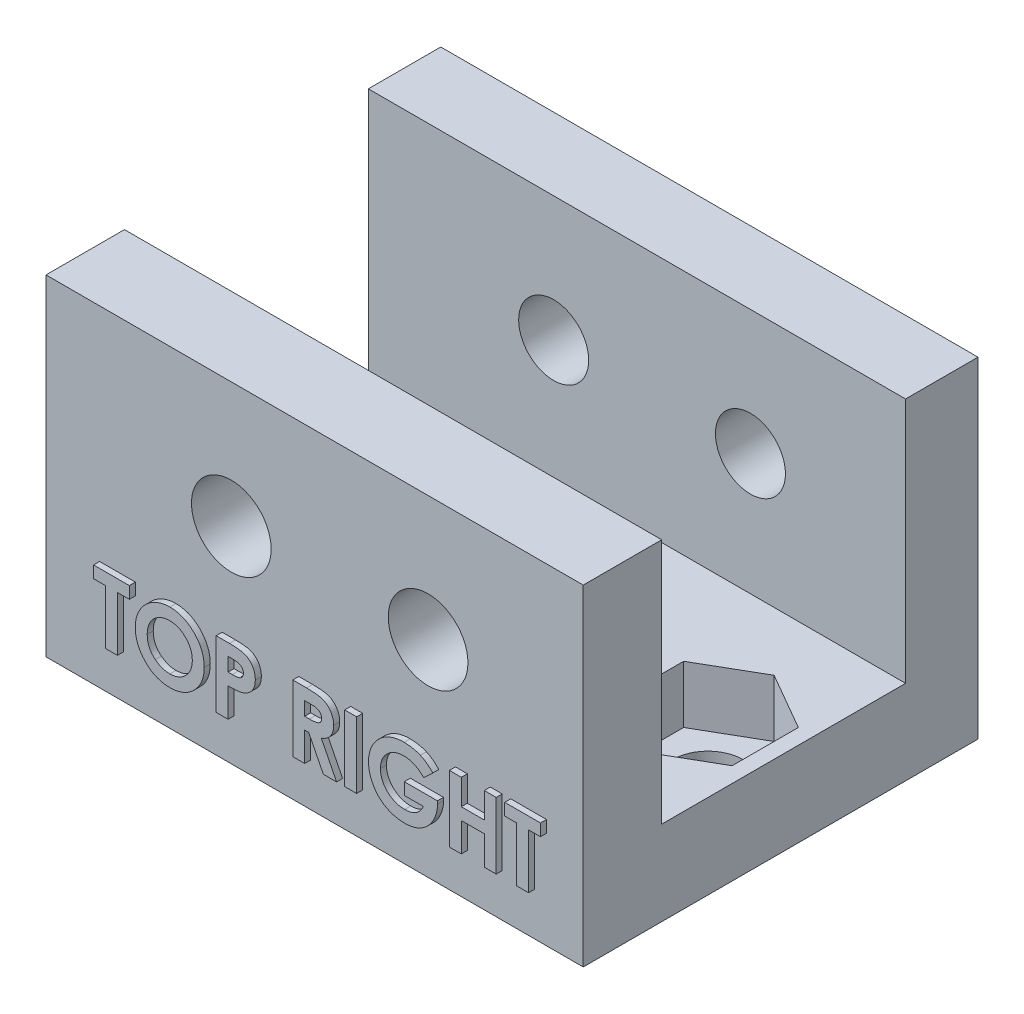
from build123d import *

# Parameters (mm, degrees)
SKETCH1_W                      = 44.5
SKETCH1_H                      = 20
BOSS_EXTRUDE1_DEPTH            = 6
SKETCH2_W                      = 44.5
SKETCH2_H                      = 0.4
SKETCH2_H_2                    = 7
BOSS_EXTRUDE2_DEPTH            = 6
SKETCH2_3_W                    = 44.5
SKETCH2_3_H                    = 7
BOSS_EXTRUDE3_DEPTH            = 20.2
BOSS_EXTRUDE4_DEPTH            = 6.5
SKETCH4_R                      = 2.9
CUT_EXTRUDE1_DEPTH             = 53.010696015
CUT_EXTRUDE2_DEPTH             = 4.75
SKETCH6_W                      = 18.5
SKETCH6_H                      = 30.7
CUT_EXTRUDE3_DEPTH             = 0.5
SKETCH10_W                     = 0.897435898
SKETCH10_H                     = 5
SKETCH10_W_2                   = 0.897435897
BOSS_EXTRUDE8_DEPTH            = 0.5
SKETCH24_W                     = 0.987179487
SKETCH24_H                     = 5.5
BOSS_EXTRUDE10_DEPTH           = 0.5
M5_CLEARANCE_HOLE4_D           = 5.8
M5_CLEARANCE_HOLE4_DEPTH       = 6
F_6_6_6_6_DIAMETER_HOLE3_D     = 6.6
F_6_6_6_6_DIAMETER_HOLE3_DEPTH = 6.5


with BuildPart() as part:
    # Sketch1 → Boss-Extrude1 (new body)
    with BuildSketch(Plane.XY):
        with Locations((7.5, 0)):
            Rectangle(SKETCH1_W, SKETCH1_H)
    extrude(amount=BOSS_EXTRUDE1_DEPTH)

    # Sketch2 → Boss-Extrude2 (add)
    with BuildSketch(Plane.XY.offset(6)):
        with Locations((7.5, -10.2)):
            Rectangle(SKETCH2_W, SKETCH2_H)
        with Locations((7.5, -13.9)):
            Rectangle(SKETCH2_W, SKETCH2_H_2)
    extrude(amount=-BOSS_EXTRUDE2_DEPTH)

    # Sketch2<3> → Boss-Extrude3 (add)
    with BuildSketch(Plane.XY.offset(6)):
        with Locations((7.5, -13.9)):
            Rectangle(SKETCH2_3_W, SKETCH2_3_H)
    extrude(amount=BOSS_EXTRUDE3_DEPTH)

    # Sketch3 → Boss-Extrude4 (add)
    with BuildSketch(Plane.XY.offset(26.2)):
        Polygon((-14.75, 10), (-14.75, -10.4), (-14.75, -17.4), (29.75, -17.4), (29.75, -10.4), (29.75, 10), align=None)
    extrude(amount=BOSS_EXTRUDE4_DEPTH)

    # Sketch4 → Cut-Extrude1 (cut, through all)
    with BuildSketch(Plane.XZ.offset(17.4)):
        with Locations(Location((-8.725, 16.35, 0), (0, 0, 270))):
            Circle(SKETCH4_R)
        with Locations(Location((23.725, 16.35, 0), (0, 0, 90))):
            Circle(SKETCH4_R)
    extrude(amount=-CUT_EXTRUDE1_DEPTH, mode=Mode.SUBTRACT)

    # Sketch5 → Cut-Extrude2 (cut)
    with BuildSketch(Plane(origin=(0, -10.4, 0), x_dir=(1, 0, 0), z_dir=(0, 1, 0))):
        Polygon((-8.725, -10.865172443), (-13.475, -13.607586221), (-13.475, -19.092413779), (-8.725, -21.834827557), (-3.975, -19.092413779), (-3.975, -13.607586221), align=None)
        Polygon((23.725, -10.865172443), (18.975, -13.607586221), (18.975, -19.092413779), (23.725, -21.834827557), (28.475, -19.092413779), (28.475, -13.607586221), align=None)
    extrude(amount=-CUT_EXTRUDE2_DEPTH, mode=Mode.SUBTRACT)

    # Sketch6 → Cut-Extrude3 (cut)
    with BuildSketch(Plane.XZ.offset(17.4)):
        with Locations((7.5, 16.35)):
            Rectangle(SKETCH6_W, SKETCH6_H)
    extrude(amount=-CUT_EXTRUDE3_DEPTH, mode=Mode.SUBTRACT)

    # Sketch10 → Boss-Extrude8 (add)
    # profile 1 of 10: a face of its own
    with BuildSketch(Plane(origin=(0, 0, 0), x_dir=(-1, 0, 0), z_dir=(0, 0, -1))):
        Polygon((-26.668714773, -7.143670574), (-23.976407081, -7.143670574), (-23.976407081, -8.041106471), (-24.873842978, -8.041106471), (-24.873842978, -12.143670574), (-25.771278876, -12.143670574), (-25.771278876, -8.041106471), (-26.668714773, -8.041106471), align=None)
    # profile 2 of 10: a face of its own
    with BuildSketch(Plane(origin=(0, 0, 0), x_dir=(-1, 0, 0), z_dir=(0, 0, -1))):
        Polygon((-23.271278876, -7.143670574), (-22.373842978, -7.143670574), (-22.373842978, -9.066747497), (-20.643073748, -9.066747497), (-20.643073748, -7.143670574), (-19.74563785, -7.143670574), (-19.74563785, -12.143670574), (-20.643073748, -12.143670574), (-20.643073748, -9.964183394), (-22.373842978, -9.964183394), (-22.373842978, -12.143670574), (-23.271278876, -12.143670574), align=None)
    # profile 3 of 10: a face of its own
    with BuildSketch(Plane(origin=(0, 0, 0), x_dir=(-1, 0, 0), z_dir=(0, 0, -1))):
        with Locations((-18.271278876, -9.643670574)):
            Rectangle(SKETCH10_W, SKETCH10_H)
    # profile 4 of 10: a face of its own
    with BuildSketch(Plane(origin=(0, 0, 0), x_dir=(-1, 0, 0), z_dir=(0, 0, -1))):
        with BuildLine():
            Line((-14.104612209, -7.811739484), (-14.775685927, -8.425721856))
            add(Edge.make_bspline(
                [(-14.775685927, -8.425721856), (-14.804431848, -8.385172746), (-14.859620007, -8.307324111), (-14.949074256, -8.203082953), (-15.038124573, -8.114157489), (-15.127595955, -8.040919206), (-15.218281443, -7.983813082), (-15.31002362, -7.943381316), (-15.402302374, -7.917678458), (-15.464299451, -7.914477834), (-15.494836568, -7.912901343)],
                knots=[0, 0, 0, 0, 1.299362458, 2.494594718, 3.587462134, 4.587049575, 5.512617175, 6.380583204, 7.202344345, 8, 8, 8, 8], degree=3))
            add(Edge.make_bspline(
                [(-15.494836568, -7.912901343), (-15.523320715, -7.91390028), (-15.578316118, -7.915828965), (-15.656716146, -7.934999949), (-15.726320806, -7.968086252), (-15.78706217, -8.011349377), (-15.835178291, -8.063471413), (-15.873595283, -8.118134027), (-15.895227277, -8.17846919), (-15.898074473, -8.219909814), (-15.899484004, -8.240425381)],
                knots=[0, 0, 0, 0, 1.185010067, 2.2879431, 3.333075148, 4.379039566, 5.372662701, 6.27520591, 7.14612461, 8, 8, 8, 8], degree=3))
            add(Edge.make_bspline(
                [(-15.899484004, -8.240425381), (-15.898600723, -8.261236792), (-15.896821916, -8.303148081), (-15.879641068, -8.364574295), (-15.853744624, -8.424594857), (-15.828999514, -8.461132229), (-15.816350991, -8.479808394)],
                knots=[0, 0, 0, 0, 0.967525499, 1.948461899, 2.951351359, 4, 4, 4, 4], degree=3))
            add(Edge.make_bspline(
                [(-15.816350991, -8.479808394), (-15.804852116, -8.494325182), (-15.778383224, -8.527740911), (-15.727912468, -8.580666217), (-15.664531799, -8.64550435), (-15.585802193, -8.720025715), (-15.494991935, -8.806910394), (-15.387891852, -8.902742915), (-15.26758475, -9.010491101), (-15.182073249, -9.085523036), (-15.137264453, -9.124840446)],
                knots=[0, 0, 0, 0, 0.473873513, 1.090794244, 1.870441696, 2.795289791, 3.865433203, 5.087734844, 6.473946851, 8, 8, 8, 8], degree=3))
            add(Edge.make_bspline(
                [(-15.137264453, -9.124840446), (-15.095204952, -9.161240822), (-15.015384758, -9.230321174), (-14.901816473, -9.328369642), (-14.802008864, -9.416581457), (-14.714507964, -9.493632751), (-14.6406402, -9.560331966), (-14.580095033, -9.616997924), (-14.532133004, -9.662527443), (-14.504869399, -9.690027301), (-14.493234004, -9.701763522)],
                knots=[0, 0, 0, 0, 1.543621617, 2.929473131, 4.163658386, 5.240097082, 6.164993805, 6.925417477, 7.541396219, 8, 8, 8, 8], degree=3))
            add(Edge.make_bspline(
                [(-14.493234004, -9.701763522), (-14.449091741, -9.749534906), (-14.364234808, -9.84136828), (-14.25395071, -9.98368113), (-14.163183329, -10.12260749), (-14.092963963, -10.260761484), (-14.039931473, -10.4001364), (-14.002542865, -10.5441504), (-13.980150579, -10.69430834), (-13.977664512, -10.796772803), (-13.976407081, -10.848598458)],
                knots=[0, 0, 0, 0, 1.206664779, 2.319633467, 3.337109185, 4.282041471, 5.190008762, 6.099243693, 7.03861361, 8, 8, 8, 8], degree=3))
            add(Edge.make_bspline(
                [(-13.976407081, -10.848598458), (-13.977302088, -10.899096203), (-13.979058126, -10.998174658), (-14.000566223, -11.143161219), (-14.031235506, -11.28191965), (-14.078655599, -11.412940063), (-14.136450927, -11.538373119), (-14.208905718, -11.65626497), (-14.293993935, -11.767808728), (-14.391518096, -11.871010414), (-14.499391399, -11.964658791), (-14.615095768, -12.048026788), (-14.739762619, -12.116857688), (-14.872326819, -12.173535025), (-15.012717408, -12.217188668), (-15.160767139, -12.249452779), (-15.316702465, -12.268817189), (-15.423333287, -12.270841509), (-15.477809325, -12.271875702)],
                knots=[0, 0, 0, 0, 1.043214005, 2.046824704, 3.02475056, 3.976699089, 4.921714032, 5.875962561, 6.831408892, 7.817874052, 8.806269674, 9.781291748, 10.760897367, 11.74438705, 12.757449933, 13.795994037, 14.874007457, 16, 16, 16, 16], degree=3))
            add(Edge.make_bspline(
                [(-15.477809325, -12.271875702), (-15.52057255, -12.271117054), (-15.605268261, -12.269614496), (-15.730096935, -12.257347357), (-15.85063313, -12.237549502), (-15.966741074, -12.20917326), (-16.078943853, -12.173216714), (-16.187246076, -12.129297169), (-16.290900096, -12.076733891), (-16.390690209, -12.016607788), (-16.486131311, -11.946793463), (-16.578430218, -11.868718247), (-16.66667013, -11.781181307), (-16.751274844, -11.684389665), (-16.831703036, -11.578069231), (-16.91058741, -11.463700713), (-16.984422107, -11.339161588), (-17.030033084, -11.251796383), (-17.053330158, -11.207172176)],
                knots=[0, 0, 0, 0, 1.016823716, 2.013894106, 2.979844003, 3.91962641, 4.853723003, 5.779685073, 6.695824784, 7.614987388, 8.547259901, 9.504950863, 10.487499108, 11.500346958, 12.559593716, 13.656357062, 14.802919212, 16, 16, 16, 16], degree=3))
            Line((-17.053330158, -11.207172176), (-16.264067337, -10.733414164))
            add(Edge.make_bspline(
                [(-16.264067337, -10.733414164), (-16.234926179, -10.784068469), (-16.179060089, -10.881177102), (-16.084389776, -11.011654857), (-15.987404873, -11.123387457), (-15.885863176, -11.21440002), (-15.780999395, -11.285909501), (-15.672307013, -11.337015137), (-15.559709665, -11.368649468), (-15.483013466, -11.372512751), (-15.44475644, -11.374439805)],
                knots=[0, 0, 0, 0, 1.283663364, 2.460892379, 3.537111102, 4.529833553, 5.449777664, 6.316464042, 7.160231139, 8, 8, 8, 8], degree=3))
            add(Edge.make_bspline(
                [(-15.44475644, -11.374439805), (-15.405843567, -11.372866068), (-15.330346927, -11.36981279), (-15.222585133, -11.34161058), (-15.123785041, -11.297331041), (-15.038382971, -11.234150245), (-14.966069882, -11.161230003), (-14.912698672, -11.0801029), (-14.879170518, -10.992325334), (-14.875625779, -10.931349262), (-14.873842978, -10.900681792)],
                knots=[0, 0, 0, 0, 1.13588714, 2.203786484, 3.234766741, 4.283437687, 5.291419208, 6.222934724, 7.106237994, 8, 8, 8, 8], degree=3))
            add(Edge.make_bspline(
                [(-14.873842978, -10.900681792), (-14.875489322, -10.872150701), (-14.878833711, -10.814192522), (-14.903467447, -10.72801803), (-14.941977492, -10.641882729), (-14.98753759, -10.571232224), (-15.033900695, -10.512078471), (-15.07823428, -10.460824421), (-15.13222086, -10.404197667), (-15.195723547, -10.34212698), (-15.267903306, -10.274065934), (-15.348820938, -10.200021194), (-15.439403037, -10.120645006), (-15.503426643, -10.066574731), (-15.536903876, -10.038301984)],
                knots=[0, 0, 0, 0, 0.916159276, 1.861089862, 2.860218735, 3.940849679, 4.552606315, 5.27541173, 6.11797699, 7.06649574, 8.129236253, 9.306560635, 10.591630461, 12, 12, 12, 12], degree=3))
            add(Edge.make_bspline(
                [(-15.536903876, -10.038301984), (-15.600545428, -9.984455128), (-15.722692829, -9.881106714), (-15.895302604, -9.728464359), (-16.050839466, -9.585806093), (-16.187960033, -9.451368345), (-16.308411432, -9.327633872), (-16.411377914, -9.213597652), (-16.495728346, -9.108380054), (-16.584488987, -8.983756851), (-16.668829342, -8.831894914), (-16.741723343, -8.649187399), (-16.789013894, -8.466503067), (-16.794312142, -8.343858868), (-16.796919902, -8.283494292)],
                knots=[0, 0, 0, 0, 1.345494975, 2.582412109, 3.71882943, 4.751509156, 5.681369928, 6.505683931, 7.230279997, 7.856715994, 8.973648664, 10.023341002, 11.027102913, 12, 12, 12, 12], degree=3))
            add(Edge.make_bspline(
                [(-16.796919902, -8.283494292), (-16.795835338, -8.240686974), (-16.793698631, -8.15635196), (-16.774638878, -8.03234961), (-16.746153351, -7.912697761), (-16.704784187, -7.797832957), (-16.651092007, -7.687899073), (-16.585884941, -7.582357934), (-16.508150445, -7.482180918), (-16.420548916, -7.387434436), (-16.32403446, -7.300846932), (-16.220896498, -7.224424785), (-16.111718801, -7.159877528), (-15.997169263, -7.106330891), (-15.876538066, -7.065344342), (-15.750713897, -7.036291033), (-15.619516283, -7.019011052), (-15.530278498, -7.016662039), (-15.484820543, -7.015465446)],
                knots=[0, 0, 0, 0, 1.010766082, 1.991317756, 2.957454644, 3.913069143, 4.869106762, 5.843196583, 6.838735724, 7.860187025, 8.887984031, 9.89767229, 10.887916223, 11.879572884, 12.879850636, 13.892031539, 14.926195476, 16, 16, 16, 16], degree=3))
            add(Edge.make_bspline(
                [(-15.484820543, -7.015465446), (-15.425909282, -7.017620545), (-15.308551785, -7.021913732), (-15.135035341, -7.055485054), (-14.965551733, -7.108279493), (-14.828978666, -7.171970176), (-14.720310025, -7.23366737), (-14.637025663, -7.290470375), (-14.552279342, -7.35554127), (-14.465387635, -7.429085111), (-14.377965125, -7.51248756), (-14.287525972, -7.603763157), (-14.195302519, -7.703700735), (-14.135371897, -7.775095677), (-14.104612209, -7.811739484)],
                knots=[0, 0, 0, 0, 1.282922637, 2.555718331, 3.837320111, 5.142675274, 5.830281639, 6.55870424, 7.337177975, 8.157850921, 9.037902056, 9.96903443, 10.957596896, 12, 12, 12, 12], degree=3))
        make_face()
    # profile 5 of 10: a face of its own
    with BuildSketch(Plane(origin=(0, 0, 0), x_dir=(-1, 0, 0), z_dir=(0, 0, -1))):
        with BuildLine():
            Line((-8.591791696, -7.811739484), (-9.262865414, -8.425721856))
            add(Edge.make_bspline(
                [(-9.262865414, -8.425721856), (-9.291611335, -8.385172746), (-9.346799494, -8.307324111), (-9.436253743, -8.203082953), (-9.52530406, -8.114157489), (-9.614775443, -8.040919206), (-9.705460931, -7.983813082), (-9.797203107, -7.943381316), (-9.889481861, -7.917678458), (-9.951478939, -7.914477834), (-9.982016055, -7.912901343)],
                knots=[0, 0, 0, 0, 1.299362458, 2.494594718, 3.587462134, 4.587049575, 5.512617175, 6.380583204, 7.202344345, 8, 8, 8, 8], degree=3))
            add(Edge.make_bspline(
                [(-9.982016055, -7.912901343), (-10.010500202, -7.91390028), (-10.065495605, -7.915828965), (-10.143895633, -7.934999949), (-10.213500294, -7.968086252), (-10.274241657, -8.011349377), (-10.322357778, -8.063471413), (-10.36077477, -8.118134027), (-10.382406764, -8.17846919), (-10.38525396, -8.219909814), (-10.386663491, -8.240425381)],
                knots=[0, 0, 0, 0, 1.185010067, 2.2879431, 3.333075148, 4.379039566, 5.372662701, 6.27520591, 7.14612461, 8, 8, 8, 8], degree=3))
            add(Edge.make_bspline(
                [(-10.386663491, -8.240425381), (-10.38578021, -8.261236792), (-10.384001403, -8.303148081), (-10.366820555, -8.364574295), (-10.340924111, -8.424594857), (-10.316179001, -8.461132229), (-10.303530478, -8.479808394)],
                knots=[0, 0, 0, 0, 0.967525499, 1.948461899, 2.951351359, 4, 4, 4, 4], degree=3))
            add(Edge.make_bspline(
                [(-10.303530478, -8.479808394), (-10.292031603, -8.494325182), (-10.265562711, -8.527740911), (-10.215091955, -8.580666217), (-10.151711286, -8.64550435), (-10.072981681, -8.720025715), (-9.982171423, -8.806910394), (-9.875071339, -8.902742915), (-9.754764237, -9.010491101), (-9.669252736, -9.085523036), (-9.62444394, -9.124840446)],
                knots=[0, 0, 0, 0, 0.473873513, 1.090794244, 1.870441696, 2.795289791, 3.865433203, 5.087734844, 6.473946851, 8, 8, 8, 8], degree=3))
            add(Edge.make_bspline(
                [(-9.62444394, -9.124840446), (-9.582384439, -9.161240822), (-9.502564245, -9.230321174), (-9.38899596, -9.328369642), (-9.289188352, -9.416581457), (-9.201687451, -9.493632751), (-9.127819688, -9.560331966), (-9.06727452, -9.616997924), (-9.019312491, -9.662527443), (-8.992048886, -9.690027301), (-8.980413491, -9.701763522)],
                knots=[0, 0, 0, 0, 1.543621617, 2.929473131, 4.163658386, 5.240097082, 6.164993805, 6.925417477, 7.541396219, 8, 8, 8, 8], degree=3))
            add(Edge.make_bspline(
                [(-8.980413491, -9.701763522), (-8.936271228, -9.749534906), (-8.851414295, -9.84136828), (-8.741130197, -9.98368113), (-8.650362817, -10.12260749), (-8.58014345, -10.260761484), (-8.52711096, -10.4001364), (-8.489722352, -10.5441504), (-8.467330066, -10.69430834), (-8.464844, -10.796772803), (-8.463586568, -10.848598458)],
                knots=[0, 0, 0, 0, 1.206664779, 2.319633467, 3.337109185, 4.282041471, 5.190008762, 6.099243693, 7.03861361, 8, 8, 8, 8], degree=3))
            add(Edge.make_bspline(
                [(-8.463586568, -10.848598458), (-8.464481576, -10.899096203), (-8.466237614, -10.998174658), (-8.48774571, -11.143161219), (-8.518414994, -11.28191965), (-8.565835086, -11.412940063), (-8.623630414, -11.538373119), (-8.696085205, -11.65626497), (-8.781173422, -11.767808728), (-8.878697583, -11.871010414), (-8.986570886, -11.964658791), (-9.102275255, -12.048026788), (-9.226942107, -12.116857688), (-9.359506306, -12.173535025), (-9.499896895, -12.217188668), (-9.647946627, -12.249452779), (-9.803881952, -12.268817189), (-9.910512775, -12.270841509), (-9.964988812, -12.271875702)],
                knots=[0, 0, 0, 0, 1.043214005, 2.046824704, 3.02475056, 3.976699089, 4.921714032, 5.875962561, 6.831408892, 7.817874052, 8.806269674, 9.781291748, 10.760897367, 11.74438705, 12.757449933, 13.795994037, 14.874007457, 16, 16, 16, 16], degree=3))
            add(Edge.make_bspline(
                [(-9.964988812, -12.271875702), (-10.007752037, -12.271117054), (-10.092447748, -12.269614496), (-10.217276422, -12.257347357), (-10.337812617, -12.237549502), (-10.453920561, -12.20917326), (-10.566123341, -12.173216714), (-10.674425563, -12.129297169), (-10.778079583, -12.076733891), (-10.877869696, -12.016607788), (-10.973310798, -11.946793463), (-11.065609705, -11.868718247), (-11.153849617, -11.781181307), (-11.238454331, -11.684389665), (-11.318882524, -11.578069231), (-11.397766898, -11.463700713), (-11.471601594, -11.339161588), (-11.517212571, -11.251796383), (-11.540509645, -11.207172176)],
                knots=[0, 0, 0, 0, 1.016823716, 2.013894106, 2.979844003, 3.91962641, 4.853723003, 5.779685073, 6.695824784, 7.614987388, 8.547259901, 9.504950863, 10.487499108, 11.500346958, 12.559593716, 13.656357062, 14.802919212, 16, 16, 16, 16], degree=3))
            Line((-11.540509645, -11.207172176), (-10.751246825, -10.733414164))
            add(Edge.make_bspline(
                [(-10.751246825, -10.733414164), (-10.722105667, -10.784068469), (-10.666239576, -10.881177102), (-10.571569263, -11.011654857), (-10.47458436, -11.123387457), (-10.373042664, -11.21440002), (-10.268178882, -11.285909501), (-10.1594865, -11.337015137), (-10.046889152, -11.368649468), (-9.970192953, -11.372512751), (-9.931935927, -11.374439805)],
                knots=[0, 0, 0, 0, 1.283663364, 2.460892379, 3.537111102, 4.529833553, 5.449777664, 6.316464042, 7.160231139, 8, 8, 8, 8], degree=3))
            add(Edge.make_bspline(
                [(-9.931935927, -11.374439805), (-9.893023054, -11.372866068), (-9.817526414, -11.36981279), (-9.70976462, -11.34161058), (-9.610964528, -11.297331041), (-9.525562458, -11.234150245), (-9.453249369, -11.161230003), (-9.399878159, -11.0801029), (-9.366350005, -10.992325334), (-9.362805266, -10.931349262), (-9.361022466, -10.900681792)],
                knots=[0, 0, 0, 0, 1.13588714, 2.203786484, 3.234766741, 4.283437687, 5.291419208, 6.222934724, 7.106237994, 8, 8, 8, 8], degree=3))
            add(Edge.make_bspline(
                [(-9.361022466, -10.900681792), (-9.362668809, -10.872150701), (-9.366013198, -10.814192522), (-9.390646935, -10.72801803), (-9.429156979, -10.641882729), (-9.474717077, -10.571232224), (-9.521080182, -10.512078471), (-9.565413767, -10.460824421), (-9.619400347, -10.404197667), (-9.682903034, -10.34212698), (-9.755082793, -10.274065934), (-9.836000425, -10.200021194), (-9.926582524, -10.120645006), (-9.99060613, -10.066574731), (-10.024083363, -10.038301984)],
                knots=[0, 0, 0, 0, 0.916159276, 1.861089862, 2.860218735, 3.940849679, 4.552606315, 5.27541173, 6.11797699, 7.06649574, 8.129236253, 9.306560635, 10.591630461, 12, 12, 12, 12], degree=3))
            add(Edge.make_bspline(
                [(-10.024083363, -10.038301984), (-10.087724915, -9.984455128), (-10.209872316, -9.881106714), (-10.382482091, -9.728464359), (-10.538018954, -9.585806093), (-10.67513952, -9.451368345), (-10.795590919, -9.327633872), (-10.898557401, -9.213597652), (-10.982907833, -9.108380054), (-11.071668474, -8.983756851), (-11.156008829, -8.831894914), (-11.22890283, -8.649187399), (-11.276193381, -8.466503067), (-11.28149163, -8.343858868), (-11.284099389, -8.283494292)],
                knots=[0, 0, 0, 0, 1.345494975, 2.582412109, 3.71882943, 4.751509156, 5.681369928, 6.505683931, 7.230279997, 7.856715994, 8.973648664, 10.023341002, 11.027102913, 12, 12, 12, 12], degree=3))
            add(Edge.make_bspline(
                [(-11.284099389, -8.283494292), (-11.283014825, -8.240686974), (-11.280878119, -8.15635196), (-11.261818365, -8.03234961), (-11.233332838, -7.912697761), (-11.191963674, -7.797832957), (-11.138271494, -7.687899073), (-11.073064428, -7.582357934), (-10.995329932, -7.482180918), (-10.907728403, -7.387434436), (-10.811213947, -7.300846932), (-10.708075986, -7.224424785), (-10.598898289, -7.159877528), (-10.48434875, -7.106330891), (-10.363717554, -7.065344342), (-10.237893384, -7.036291033), (-10.106695771, -7.019011052), (-10.017457986, -7.016662039), (-9.97200003, -7.015465446)],
                knots=[0, 0, 0, 0, 1.010766082, 1.991317756, 2.957454644, 3.913069143, 4.869106762, 5.843196583, 6.838735724, 7.860187025, 8.887984031, 9.89767229, 10.887916223, 11.879572884, 12.879850636, 13.892031539, 14.926195476, 16, 16, 16, 16], degree=3))
            add(Edge.make_bspline(
                [(-9.97200003, -7.015465446), (-9.913088769, -7.017620545), (-9.795731272, -7.021913732), (-9.622214828, -7.055485054), (-9.45273122, -7.108279493), (-9.316158153, -7.171970176), (-9.207489512, -7.23366737), (-9.12420515, -7.290470375), (-9.039458829, -7.35554127), (-8.952567122, -7.429085111), (-8.865144612, -7.51248756), (-8.774705459, -7.603763157), (-8.682482006, -7.703700735), (-8.622551384, -7.775095677), (-8.591791696, -7.811739484)],
                knots=[0, 0, 0, 0, 1.282922637, 2.555718331, 3.837320111, 5.142675274, 5.830281639, 6.55870424, 7.337177975, 8.157850921, 9.037902056, 9.96903443, 10.957596896, 12, 12, 12, 12], degree=3))
        make_face()
    # profile 6 of 10: a face of its own
    with BuildSketch(Plane(origin=(0, 0, 0), x_dir=(-1, 0, 0), z_dir=(0, 0, -1))):
        with Locations((-7.245637851, -9.643670574)):
            Rectangle(SKETCH10_W_2, SKETCH10_H)
    # profile 7 of 10: a face of its own
    with BuildSketch(Plane(origin=(0, 0, 0), x_dir=(-1, 0, 0), z_dir=(0, 0, -1))):
        with BuildLine():
            Line((-5.643073748, -7.143670574), (-4.512264453, -7.143670574))
            add(Edge.make_bspline(
                [(-4.512264453, -7.143670574), (-4.424104862, -7.144286839), (-4.253691375, -7.145478088), (-4.006795947, -7.158900595), (-3.777214617, -7.179543458), (-3.564799392, -7.207941456), (-3.369985758, -7.245519785), (-3.193024923, -7.292654433), (-3.033322964, -7.347063543), (-2.889128782, -7.411086902), (-2.757493363, -7.485731779), (-2.632501332, -7.56888018), (-2.514398107, -7.663578074), (-2.401526297, -7.767998548), (-2.295342535, -7.884051944), (-2.194078483, -8.009815997), (-2.100213543, -8.147114459), (-2.010910382, -8.292655346), (-1.930147555, -8.447055447), (-1.8597032, -8.609000539), (-1.800691537, -8.777448447), (-1.752741505, -8.952578691), (-1.714519795, -9.133809893), (-1.687776835, -9.321507759), (-1.671244071, -9.515498514), (-1.66956696, -9.646975573), (-1.668714773, -9.713782753)],
                knots=[0, 0, 0, 0, 1.44355588, 2.790409838, 4.047694926, 5.217575253, 6.298404546, 7.294384826, 8.214239204, 9.058592145, 9.873746385, 10.689560431, 11.514393297, 12.350027578, 13.205127629, 14.088021785, 14.991911688, 15.926770944, 16.882954281, 17.842803888, 18.816321264, 19.80318086, 20.814351908, 21.847355356, 22.906180909, 24, 24, 24, 24], degree=3))
            add(Edge.make_bspline(
                [(-1.668714773, -9.713782753), (-1.670946259, -9.808052033), (-1.675339069, -9.993626627), (-1.712341645, -10.265955206), (-1.772187341, -10.527009311), (-1.856335824, -10.774746875), (-1.960657417, -11.006961759), (-2.085281241, -11.21955895), (-2.228380022, -11.411397334), (-2.38828665, -11.581521715), (-2.561426583, -11.727745925), (-2.741353887, -11.852976261), (-2.929821382, -11.95173083), (-3.095887584, -12.014355995), (-3.239887699, -12.053303429), (-3.366318242, -12.076321738), (-3.50993044, -12.097430915), (-3.672063349, -12.113743633), (-3.85200573, -12.128290569), (-4.050474834, -12.136194808), (-4.266828076, -12.142762057), (-4.417105858, -12.1433598), (-4.495237209, -12.143670574)],
                knots=[0, 0, 0, 0, 1.315458931, 2.589557908, 3.828601765, 5.048913369, 6.235739168, 7.376350998, 8.481830359, 9.569842114, 10.627874879, 11.640079404, 12.624025415, 13.590060155, 14.111227486, 14.704434459, 15.382649715, 16.137166398, 16.978595427, 17.902333227, 18.909396075, 20, 20, 20, 20], degree=3))
            Line((-4.495237209, -12.143670574), (-5.643073748, -12.143670574))
            Line((-5.643073748, -12.143670574), (-5.643073748, -7.143670574))
        make_face()
        with BuildLine():
            Line((-4.74563785, -8.041106471), (-4.74563785, -11.246234676))
            Line((-4.74563785, -11.246234676), (-4.27688785, -11.246234676))
            add(Edge.make_bspline(
                [(-4.27688785, -11.246234676), (-4.221113799, -11.246132475), (-4.113841732, -11.245935908), (-3.958965148, -11.23657326), (-3.815743579, -11.227175743), (-3.684571279, -11.209338942), (-3.564493617, -11.18947), (-3.457160145, -11.161819647), (-3.360358256, -11.132775294), (-3.275270364, -11.095798232), (-3.197336788, -11.054178088), (-3.125179199, -11.005415264), (-3.055526922, -10.951265987), (-2.989682165, -10.89013765), (-2.927395719, -10.822839707), (-2.869036111, -10.749025401), (-2.813824395, -10.668919943), (-2.763177751, -10.582099793), (-2.716896576, -10.489481794), (-2.675839988, -10.391963085), (-2.641798018, -10.288731545), (-2.613504417, -10.180753546), (-2.593285431, -10.067089017), (-2.576558076, -9.948579855), (-2.567934638, -9.824756537), (-2.566751124, -9.740503013), (-2.566150671, -9.697757112)],
                knots=[0, 0, 0, 0, 1.50275155, 2.890291501, 4.180787663, 5.369391935, 6.45668281, 7.458360028, 8.354766181, 9.177074746, 9.954075863, 10.732690366, 11.5210699, 12.329727389, 13.151100085, 13.990027547, 14.863562427, 15.770965086, 16.696477834, 17.652329173, 18.619756807, 19.62365428, 20.657822005, 21.729286259, 22.847956731, 24, 24, 24, 24], degree=3))
            add(Edge.make_bspline(
                [(-2.566150671, -9.697757112), (-2.567346571, -9.63225306), (-2.569678483, -9.504525233), (-2.592166939, -9.318486865), (-2.628773855, -9.143303872), (-2.681008397, -8.979626404), (-2.746851657, -8.826994443), (-2.829269845, -8.686701104), (-2.924716, -8.556389652), (-3.000192215, -8.479944773), (-3.037905478, -8.441747497)],
                knots=[0, 0, 0, 0, 1.13821349, 2.219428113, 3.251817212, 4.244760574, 5.201143372, 6.134805572, 7.068016741, 8, 8, 8, 8], degree=3))
            add(Edge.make_bspline(
                [(-3.037905478, -8.441747497), (-3.075094327, -8.409198253), (-3.15104834, -8.34272011), (-3.284398627, -8.263062292), (-3.431343736, -8.193075092), (-3.595245332, -8.137583047), (-3.774519378, -8.093697573), (-3.970233634, -8.063430834), (-4.181340008, -8.043981749), (-4.327589585, -8.042085431), (-4.403089773, -8.041106471)],
                knots=[0, 0, 0, 0, 0.813307809, 1.661089106, 2.549956539, 3.493439533, 4.508053171, 5.589449661, 6.755572447, 8, 8, 8, 8], degree=3))
            Line((-4.403089773, -8.041106471), (-4.74563785, -8.041106471))
        make_face(mode=Mode.SUBTRACT)
    # profile 8 of 10: a face of its own
    with BuildSketch(Plane(origin=(0, 0, 0), x_dir=(-1, 0, 0), z_dir=(0, 0, -1))):
        Polygon((-0.771278876, -7.143670574), (1.921028816, -7.143670574), (1.921028816, -8.041106471), (0.126157022, -8.041106471), (0.126157022, -9.002644933), (1.921028816, -9.002644933), (1.921028816, -9.90008083), (0.126157022, -9.90008083), (0.126157022, -11.246234676), (1.921028816, -11.246234676), (1.921028816, -12.143670574), (-0.771278876, -12.143670574), align=None)
    # profile 9 of 10: a face of its own
    with BuildSketch(Plane(origin=(0, 0, 0), x_dir=(-1, 0, 0), z_dir=(0, 0, -1))):
        with BuildLine():
            Line((4.741541637, -7.143670574), (5.638977534, -7.143670574))
            Line((5.638977534, -7.143670574), (5.638977534, -10.396875702))
            add(Edge.make_bspline(
                [(5.638977534, -10.396875702), (5.639026332, -10.430603522), (5.639120586, -10.495748457), (5.643838945, -10.589210111), (5.648156569, -10.675120939), (5.655946788, -10.753386888), (5.667455613, -10.824041438), (5.67859991, -10.887538447), (5.693682614, -10.942741075), (5.716349507, -11.005576117), (5.751271748, -11.076174719), (5.808332753, -11.149754202), (5.874176271, -11.216906159), (5.95309352, -11.272800905), (6.041789528, -11.318014716), (6.139776951, -11.351513146), (6.246917661, -11.370133825), (6.320999584, -11.372976613), (6.359129778, -11.374439805)],
                knots=[0, 0, 0, 0, 1.155499968, 2.231836252, 3.205919964, 4.102923608, 4.924856345, 5.658536265, 6.31071849, 6.882491295, 7.94666036, 8.992281882, 10.060072772, 11.158554251, 12.289267114, 13.461410017, 14.693379945, 16, 16, 16, 16], degree=3))
            add(Edge.make_bspline(
                [(6.359129778, -11.374439805), (6.399638403, -11.373257734), (6.478623364, -11.370952895), (6.592230656, -11.348328412), (6.697488456, -11.312302487), (6.792168098, -11.260884311), (6.87617536, -11.199250616), (6.947285747, -11.128968888), (7.003405803, -11.049898953), (7.039982768, -10.976950916), (7.060518932, -10.9098086), (7.075911811, -10.849819489), (7.087196493, -10.779038276), (7.097434328, -10.698570363), (7.103586478, -10.607582256), (7.110257482, -10.506805694), (7.112702467, -10.395551136), (7.113119197, -10.3180825), (7.113336509, -10.277684997)],
                knots=[0, 0, 0, 0, 1.261321664, 2.459363699, 3.594844139, 4.716940403, 5.803436589, 6.833651888, 7.818396249, 8.814403945, 9.360733334, 10.004355033, 10.743453831, 11.592799886, 12.532235708, 13.585170094, 14.740740724, 16, 16, 16, 16], degree=3))
            Line((7.113336509, -10.277684997), (7.113336509, -7.143670574))
            Line((7.113336509, -7.143670574), (8.010772406, -7.143670574))
            Line((8.010772406, -7.143670574), (8.010772406, -10.12644301))
            add(Edge.make_bspline(
                [(8.010772406, -10.12644301), (8.010647781, -10.186873837), (8.010408139, -10.303076423), (8.006727956, -10.470067718), (7.998893512, -10.622587479), (7.992313483, -10.760680272), (7.979578874, -10.884160064), (7.966312399, -10.993554148), (7.949403134, -11.088474857), (7.924243166, -11.196530548), (7.880824509, -11.32095272), (7.810827941, -11.464219457), (7.72197183, -11.60448627), (7.616948346, -11.740210129), (7.498367226, -11.866293219), (7.368857667, -11.976977853), (7.230477254, -12.070605117), (7.081780011, -12.144885713), (6.922892487, -12.202818978), (6.752242609, -12.241747214), (6.569946745, -12.268047619), (6.444031546, -12.270574097), (6.379161829, -12.271875702)],
                knots=[0, 0, 0, 0, 1.170808336, 2.251350247, 3.235597562, 4.129743112, 4.929140599, 5.639994148, 6.264258765, 6.79612947, 7.788252245, 8.809469599, 9.879094798, 10.999557536, 12.129761673, 13.226370002, 14.293821979, 15.358369427, 16.438775801, 17.562147481, 18.744053101, 20, 20, 20, 20], degree=3))
            add(Edge.make_bspline(
                [(6.379161829, -12.271875702), (6.336061099, -12.271149727), (6.251024241, -12.269717394), (6.125962625, -12.257087953), (6.005066006, -12.238476907), (5.888561547, -12.211325306), (5.776044885, -12.17625051), (5.667545912, -12.133075879), (5.563467837, -12.082042235), (5.464393065, -12.023618977), (5.370443516, -11.960444281), (5.284578479, -11.890412471), (5.203843135, -11.818702665), (5.130569894, -11.742297008), (5.06420841, -11.66199763), (5.004895353, -11.577622546), (4.952718844, -11.489179251), (4.906366411, -11.39507356), (4.866693253, -11.29052242), (4.833247289, -11.171806903), (4.804028109, -11.037066264), (4.782314138, -10.885996937), (4.762628125, -10.719096832), (4.750167964, -10.535931147), (4.743649492, -10.336494627), (4.742262009, -10.198229423), (4.741541637, -10.12644301)],
                knots=[0, 0, 0, 0, 1.001158378, 1.975264943, 2.917723546, 3.841610987, 4.75185031, 5.653588123, 6.552117133, 7.442167995, 8.324307438, 9.179605724, 10.014504199, 10.831958861, 11.636465792, 12.43274043, 13.225645099, 14.020104002, 14.867201867, 15.819789774, 16.883317127, 18.068162734, 19.364263498, 20.787406516, 22.332041935, 24, 24, 24, 24], degree=3))
            Line((4.741541637, -10.12644301), (4.741541637, -7.143670574))
        make_face()
    # profile 10 of 10: a face of its own
    with BuildSketch(Plane(origin=(0, 0, 0), x_dir=(-1, 0, 0), z_dir=(0, 0, -1))):
        with BuildLine():
            Line((9.16461856, -7.143670574), (10.166221124, -7.143670574))
            add(Edge.make_bspline(
                [(10.166221124, -7.143670574), (10.231664536, -7.143963512), (10.357918596, -7.144528652), (10.539987338, -7.151381727), (10.707954667, -7.163662855), (10.861781992, -7.178840386), (11.001406065, -7.200118694), (11.127001735, -7.224512609), (11.238595068, -7.254231497), (11.337444444, -7.289507404), (11.426158566, -7.331096321), (11.510110738, -7.375391486), (11.587403632, -7.428256204), (11.661938455, -7.483992939), (11.72945392, -7.5479262), (11.794162048, -7.615801136), (11.853322273, -7.690309612), (11.907208721, -7.770549721), (11.956092033, -7.855038971), (11.998799764, -7.943928402), (12.033441884, -8.037358674), (12.062502315, -8.134725397), (12.085843937, -8.23602433), (12.101380863, -8.341878469), (12.111934325, -8.4515487), (12.112865522, -8.526190329), (12.113336509, -8.56394301)],
                knots=[0, 0, 0, 0, 1.698747864, 3.27724071, 4.728299578, 6.070144658, 7.288476769, 8.393259625, 9.389771311, 10.283485332, 11.113357557, 11.931608583, 12.74405601, 13.541433047, 14.344816069, 15.154114104, 15.974336324, 16.810834471, 17.661136416, 18.50621059, 19.367396281, 20.244825668, 21.142564693, 22.063065223, 23.020325768, 24, 24, 24, 24], degree=3))
            add(Edge.make_bspline(
                [(12.113336509, -8.56394301), (12.11265505, -8.605707902), (12.111315901, -8.687781046), (12.09818792, -8.808090207), (12.075761182, -8.9227941), (12.046450608, -9.032860042), (12.005579097, -9.136477205), (11.958885315, -9.236117927), (11.901437153, -9.328988587), (11.835793443, -9.416250886), (11.764103023, -9.498614307), (11.684663965, -9.573700762), (11.598990412, -9.642022113), (11.507578298, -9.704294373), (11.410084433, -9.760391925), (11.306579165, -9.810840064), (11.196355701, -9.8540253), (11.119599397, -9.876610829), (11.080684265, -9.888061599)],
                knots=[0, 0, 0, 0, 1.102006807, 2.165578795, 3.188629044, 4.184801286, 5.166646146, 6.124351954, 7.085497154, 8.042432466, 9.003981491, 9.963833307, 10.922997304, 11.89326795, 12.880200226, 13.889073926, 14.929769137, 16, 16, 16, 16], degree=3))
            add(Edge.make_bspline(
                [(11.080684265, -9.888061599), (11.055052521, -9.894438819), (10.999525909, -9.90825393), (10.907644618, -9.922279735), (10.801761077, -9.9351756), (10.681532895, -9.946258035), (10.546890758, -9.953791509), (10.397965036, -9.959674816), (10.234688236, -9.963952589), (10.121152006, -9.964104383), (10.062054457, -9.964183394)],
                knots=[0, 0, 0, 0, 0.618981996, 1.340914327, 2.176866532, 3.120127938, 4.170906482, 5.338178032, 6.614476169, 8, 8, 8, 8], degree=3))
            Line((10.062054457, -9.964183394), (10.062054457, -12.143670574))
            Line((10.062054457, -12.143670574), (9.16461856, -12.143670574))
            Line((9.16461856, -12.143670574), (9.16461856, -7.143670574))
        make_face()
        with BuildLine():
            Line((10.062054457, -9.066747497), (10.37956247, -9.066747497))
            add(Edge.make_bspline(
                [(10.37956247, -9.066747497), (10.437338066, -9.066381155), (10.54364602, -9.06570708), (10.688825145, -9.055959564), (10.805493882, -9.041073139), (10.897664351, -9.019722563), (10.970441667, -8.987320236), (11.033207545, -8.949836846), (11.087043441, -8.902440128), (11.133657403, -8.848281268), (11.170923861, -8.786050023), (11.196766209, -8.716759709), (11.213552889, -8.641866189), (11.215103295, -8.589745256), (11.215900611, -8.562941407)],
                knots=[0, 0, 0, 0, 1.8619151, 3.425951444, 4.686033666, 5.651700536, 6.461346321, 7.243864085, 7.999046032, 8.762387399, 9.539336099, 10.322741239, 11.137448474, 12, 12, 12, 12], degree=3))
            add(Edge.make_bspline(
                [(11.215900611, -8.562941407), (11.215111497, -8.539523233), (11.213580425, -8.494086346), (11.202332757, -8.428509647), (11.184407208, -8.367378636), (11.158433778, -8.311331745), (11.124856283, -8.260464207), (11.083918521, -8.21479606), (11.036145805, -8.173349283), (10.999262474, -8.15141087), (10.980524009, -8.140265125)],
                knots=[0, 0, 0, 0, 1.102301479, 2.1387299, 3.123554645, 4.094223062, 5.036071848, 5.982632524, 6.975082478, 8, 8, 8, 8], degree=3))
            add(Edge.make_bspline(
                [(10.980524009, -8.140265125), (10.964651447, -8.132237915), (10.93104598, -8.115242667), (10.873812612, -8.095484449), (10.80776618, -8.078816215), (10.732460795, -8.064981741), (10.648196872, -8.054244753), (10.554989446, -8.046033644), (10.452701352, -8.042731637), (10.381566103, -8.041663135), (10.34450638, -8.041106471)],
                knots=[0, 0, 0, 0, 0.656809284, 1.390599849, 2.23162475, 3.173112763, 4.218524733, 5.370385145, 6.63003504, 8, 8, 8, 8], degree=3))
            Line((10.34450638, -8.041106471), (10.062054457, -8.041106471))
            Line((10.062054457, -8.041106471), (10.062054457, -9.066747497))
        make_face(mode=Mode.SUBTRACT)
    extrude(amount=BOSS_EXTRUDE8_DEPTH)

    # Sketch24 → Boss-Extrude10 (add)
    # profile 1 of 8: a face of its own
    with BuildSketch(Plane.XY.offset(32.7)):
        Polygon((-10.310357306, -8.335872695), (-7.348818845, -8.335872695), (-7.348818845, -9.323052182), (-8.335998332, -9.323052182), (-8.335998332, -13.835872695), (-9.323177819, -13.835872695), (-9.323177819, -9.323052182), (-10.310357306, -9.323052182), align=None)
    # profile 2 of 8: a face of its own
    with BuildSketch(Plane.XY.offset(32.7)):
        with BuildLine():
            add(Edge.make_bspline(
                [(-3.988442242, -8.194847054), (-3.892818001, -8.197322937), (-3.704034092, -8.20221089), (-3.426401086, -8.242955798), (-3.158850351, -8.309343783), (-2.901502872, -8.401627883), (-2.655003018, -8.522307623), (-2.418481301, -8.66796165), (-2.192784931, -8.841339099), (-1.980226663, -9.038395359), (-1.783784488, -9.252685437), (-1.613567228, -9.483406804), (-1.468412194, -9.724581238), (-1.348107313, -9.976854972), (-1.256472753, -10.241975122), (-1.192168993, -10.518589925), (-1.150857013, -10.806620689), (-1.146105499, -11.00273038), (-1.14369064, -11.102399137)],
                knots=[0, 0, 0, 0, 1.014329547, 2.002516266, 2.970391464, 3.935626869, 4.897733899, 5.877609409, 6.878433252, 7.912639331, 8.949961323, 9.958554974, 10.949718813, 11.932905612, 12.9188844, 13.919928257, 14.942845884, 16, 16, 16, 16], degree=3))
            add(Edge.make_bspline(
                [(-1.14369064, -11.102399137), (-1.146262361, -11.200944859), (-1.15133002, -11.395132364), (-1.190482457, -11.68050881), (-1.255869101, -11.954160493), (-1.345949466, -12.21670683), (-1.464072471, -12.466876135), (-1.606396825, -12.706265705), (-1.776678195, -12.932653948), (-1.968705752, -13.145919375), (-2.180111428, -13.339503512), (-2.404023598, -13.510099199), (-2.639408376, -13.654655545), (-2.885921232, -13.773106339), (-3.144090803, -13.865031637), (-3.413279376, -13.929891615), (-3.693470296, -13.969308333), (-3.884013709, -13.974342891), (-3.980729902, -13.976898336)],
                knots=[0, 0, 0, 0, 1.051557043, 2.072126891, 3.067553643, 4.050577992, 5.02905126, 6.015227836, 7.017913613, 8.04756643, 9.074058332, 10.072836633, 11.047628519, 12.017157415, 12.98668631, 13.966869689, 14.968021931, 16, 16, 16, 16], degree=3))
            add(Edge.make_bspline(
                [(-3.980729902, -13.976898336), (-4.081883443, -13.974605976), (-4.280636325, -13.970101801), (-4.571512058, -13.927269153), (-4.850196143, -13.862748224), (-5.114347475, -13.766454197), (-5.366656208, -13.646078567), (-5.605268557, -13.497828762), (-5.830104332, -13.321949776), (-6.039873838, -13.122945935), (-6.229925518, -12.905192084), (-6.397683405, -12.675154451), (-6.539190904, -12.434590321), (-6.654453192, -12.183387105), (-6.74532135, -11.923105969), (-6.809418511, -11.652161727), (-6.847282234, -11.371204201), (-6.852556431, -11.180372233), (-6.855229101, -11.083669169)],
                knots=[0, 0, 0, 0, 1.067978421, 2.098431617, 3.099715153, 4.085208694, 5.062210972, 6.048429807, 7.046490867, 8.072918869, 9.098532598, 10.095778865, 11.076610158, 12.041847152, 13.011192615, 13.984257998, 14.978533688, 16, 16, 16, 16], degree=3))
            add(Edge.make_bspline(
                [(-6.855229101, -11.083669169), (-6.854390263, -11.018612411), (-6.852723209, -10.889322661), (-6.832641783, -10.697721852), (-6.803730304, -10.509860834), (-6.760971597, -10.32648861), (-6.709030698, -10.146311576), (-6.641733926, -9.971006864), (-6.565131987, -9.798701737), (-6.475629833, -9.631431335), (-6.376112093, -9.470734685), (-6.267529378, -9.317369822), (-6.149608658, -9.17319115), (-6.022729796, -9.037251187), (-5.886455549, -8.910443476), (-5.742578464, -8.790972878), (-5.588308164, -8.682012956), (-5.427021142, -8.580902692), (-5.259626697, -8.489470434), (-5.086806275, -8.41164603), (-4.91212032, -8.343683304), (-4.733235261, -8.290044115), (-4.552068172, -8.246355557), (-4.366683648, -8.217463564), (-4.178756534, -8.197382694), (-4.052030891, -8.195694273), (-3.988442242, -8.194847054)],
                knots=[0, 0, 0, 0, 1.034744296, 2.056386356, 3.06226378, 4.057406941, 5.050368692, 6.043467995, 7.042652155, 8.049140477, 9.059438543, 10.048523776, 11.036952808, 12.020949711, 13.004946614, 13.997082645, 14.994316842, 16.007702937, 17.024872941, 18.026463647, 19.021641123, 20.005082605, 20.995858141, 21.984425357, 22.988620895, 24, 24, 24, 24], degree=3))
        make_face()
        with BuildLine():
            add(Edge.make_bspline(
                [(-4.003866922, -9.182026541), (-4.068222023, -9.183753333), (-4.19523324, -9.187161329), (-4.381535565, -9.21312565), (-4.560392377, -9.254593622), (-4.7308122, -9.314659473), (-4.89353365, -9.391108057), (-5.048845182, -9.483672252), (-5.194596051, -9.59553385), (-5.332729705, -9.7206875), (-5.457510731, -9.860137428), (-5.567758704, -10.009581741), (-5.6600185, -10.168770872), (-5.737286657, -10.336225989), (-5.795452454, -10.513830081), (-5.836882207, -10.700191957), (-5.863064265, -10.895632726), (-5.866364546, -11.028864445), (-5.868049614, -11.096890323)],
                knots=[0, 0, 0, 0, 1.033739768, 2.040188636, 3.016340934, 3.979330865, 4.937572243, 5.900995986, 6.878200029, 7.884839167, 8.891893314, 9.879764717, 10.863503415, 11.843163062, 12.837761627, 13.859916423, 14.907309254, 16, 16, 16, 16], degree=3))
            add(Edge.make_bspline(
                [(-5.868049614, -11.096890323), (-5.865815471, -11.172278299), (-5.861436921, -11.32002624), (-5.830628911, -11.535556956), (-5.777919472, -11.739104326), (-5.701808068, -11.92967283), (-5.607409958, -12.109378589), (-5.490182488, -12.276019052), (-5.352024187, -12.430591986), (-5.245588151, -12.520838103), (-5.191567242, -12.566641926)],
                knots=[0, 0, 0, 0, 1.078454662, 2.113592447, 3.107694534, 4.079536787, 5.043276885, 6.005368276, 6.987637804, 8, 8, 8, 8], degree=3))
            add(Edge.make_bspline(
                [(-5.191567242, -12.566641926), (-5.147313804, -12.600480031), (-5.059803966, -12.667393862), (-4.920119213, -12.753157664), (-4.776271422, -12.826665798), (-4.627175081, -12.886059501), (-4.473145075, -12.932777589), (-4.314202526, -12.965493497), (-4.150572642, -12.98602556), (-4.039918445, -12.98847953), (-3.984035191, -12.989718849)],
                knots=[0, 0, 0, 0, 1.023928204, 2.024787132, 3.009472467, 3.9914905, 4.972207045, 5.96565515, 6.972602802, 8, 8, 8, 8], degree=3))
            add(Edge.make_bspline(
                [(-3.984035191, -12.989718849), (-3.920786677, -12.987977416), (-3.796343237, -12.984551091), (-3.61350903, -12.958906405), (-3.438348307, -12.915506337), (-3.269773655, -12.855967405), (-3.108271168, -12.778558944), (-2.954630152, -12.683123698), (-2.808581234, -12.570833489), (-2.670623561, -12.444036297), (-2.544523726, -12.304037033), (-2.434505818, -12.153795599), (-2.339312621, -11.996622263), (-2.263651257, -11.830292475), (-2.20318746, -11.656376311), (-2.162256335, -11.474103533), (-2.135853099, -11.284225539), (-2.132551888, -11.155006854), (-2.130870127, -11.089177984)],
                knots=[0, 0, 0, 0, 1.026359118, 2.019393844, 2.989460624, 3.950973911, 4.916101784, 5.890408035, 6.881132271, 7.902007068, 8.92769091, 9.933912415, 10.920395702, 11.90457117, 12.894218921, 13.903490204, 14.931958862, 16, 16, 16, 16], degree=3))
            add(Edge.make_bspline(
                [(-2.130870127, -11.089177984), (-2.132610077, -11.023727647), (-2.136034904, -10.894898643), (-2.161724726, -10.705508824), (-2.204849562, -10.524040727), (-2.264567283, -10.350197995), (-2.340823651, -10.183810198), (-2.435122385, -10.025462455), (-2.547132604, -9.875307847), (-2.674276399, -9.734369622), (-2.812664605, -9.604856421), (-2.961238173, -9.492462506), (-3.115839845, -9.394795768), (-3.28001694, -9.318287588), (-3.450410532, -9.257333684), (-3.62806037, -9.212446354), (-3.813639315, -9.18734373), (-3.939892509, -9.183814736), (-4.003866922, -9.182026541)],
                knots=[0, 0, 0, 0, 1.055025985, 2.07665775, 3.074803781, 4.057872707, 5.035505728, 6.020516407, 7.023567878, 8.050795229, 9.077271434, 10.074415901, 11.050397877, 12.019801805, 12.988065821, 13.964604439, 14.968634123, 16, 16, 16, 16], degree=3))
        make_face(mode=Mode.SUBTRACT)
    # profile 3 of 8: a face of its own
    with BuildSketch(Plane.XY.offset(32.7)):
        with BuildLine():
            Line((-0.156511152, -8.335872695), (0.945251668, -8.335872695))
            add(Edge.make_bspline(
                [(0.945251668, -8.335872695), (1.017239422, -8.336194928), (1.156118887, -8.336816582), (1.356394503, -8.344354964), (1.541158565, -8.357864204), (1.710368623, -8.374559489), (1.863955103, -8.397965628), (2.002110341, -8.424798934), (2.124863007, -8.45748971), (2.23359732, -8.496293209), (2.331182854, -8.542041017), (2.423530244, -8.590765699), (2.508552427, -8.648916888), (2.590540732, -8.710227297), (2.664807744, -8.780553884), (2.735986685, -8.855216314), (2.801062932, -8.937175637), (2.860338025, -9.025439757), (2.914109668, -9.118377932), (2.961088172, -9.216156307), (2.999194504, -9.318929605), (3.031160979, -9.426033001), (3.056836762, -9.537461827), (3.073927381, -9.65390138), (3.085536189, -9.774538634), (3.086560506, -9.856644426), (3.087078591, -9.898172375)],
                knots=[0, 0, 0, 0, 1.698747864, 3.27724071, 4.728299578, 6.070144658, 7.288476769, 8.393259625, 9.389771311, 10.283485332, 11.113357557, 11.931608583, 12.74405601, 13.541433047, 14.344816069, 15.154114104, 15.974336324, 16.810834471, 17.661136416, 18.50621059, 19.367396281, 20.244825668, 21.142564693, 22.063065223, 23.020325768, 24, 24, 24, 24], degree=3))
            add(Edge.make_bspline(
                [(3.087078591, -9.898172375), (3.086328987, -9.944113756), (3.084855923, -10.034394215), (3.070415144, -10.166734292), (3.045745732, -10.292908573), (3.013504101, -10.41398111), (2.968545439, -10.527959989), (2.917182278, -10.637564783), (2.853989299, -10.73972251), (2.781781219, -10.835711038), (2.702921757, -10.926310801), (2.615538793, -11.008905902), (2.521297885, -11.084059388), (2.420744559, -11.152558874), (2.313501308, -11.214266182), (2.199645513, -11.269759134), (2.078399703, -11.317262894), (1.993967768, -11.342106976), (1.951161123, -11.354702823)],
                knots=[0, 0, 0, 0, 1.102006807, 2.165578795, 3.188629044, 4.184801286, 5.166646146, 6.124351954, 7.085497154, 8.042432466, 9.003981491, 9.963833307, 10.922997304, 11.89326795, 12.880200226, 13.889073926, 14.929769137, 16, 16, 16, 16], degree=3))
            add(Edge.make_bspline(
                [(1.951161123, -11.354702823), (1.922966205, -11.361717765), (1.861886932, -11.376914387), (1.760817511, -11.392342772), (1.644345616, -11.406528224), (1.512094616, -11.418718903), (1.363988266, -11.427005723), (1.200169971, -11.433477362), (1.020565491, -11.438182912), (0.895675638, -11.438349885), (0.830668335, -11.438436798)],
                knots=[0, 0, 0, 0, 0.618981996, 1.340914327, 2.176866532, 3.120127938, 4.170906482, 5.338178032, 6.614476169, 8, 8, 8, 8], degree=3))
            Line((0.830668335, -11.438436798), (0.830668335, -13.835872695))
            Line((0.830668335, -13.835872695), (-0.156511152, -13.835872695))
            Line((-0.156511152, -13.835872695), (-0.156511152, -8.335872695))
        make_face()
        with BuildLine():
            Line((0.830668335, -10.451257311), (1.179927149, -10.451257311))
            add(Edge.make_bspline(
                [(1.179927149, -10.451257311), (1.243480304, -10.450854334), (1.360419054, -10.450112852), (1.520116091, -10.439390585), (1.648451702, -10.423015517), (1.749839218, -10.399529883), (1.829894265, -10.363887324), (1.898936731, -10.322655595), (1.958156217, -10.270519205), (2.009431575, -10.210944459), (2.050424679, -10.14249009), (2.078851261, -10.066270744), (2.09731661, -9.983887872), (2.099022057, -9.926554846), (2.099899104, -9.897070612)],
                knots=[0, 0, 0, 0, 1.8619151, 3.425951444, 4.686033666, 5.651700536, 6.461346321, 7.243864085, 7.999046032, 8.762387399, 9.539336099, 10.322741239, 11.137448474, 12, 12, 12, 12], degree=3))
            add(Edge.make_bspline(
                [(2.099899104, -9.897070612), (2.099031078, -9.871310621), (2.0973469, -9.821330045), (2.084974464, -9.749195676), (2.065256361, -9.681951564), (2.036685587, -9.620299984), (1.999750343, -9.564345692), (1.954718805, -9.51411073), (1.902168817, -9.468519275), (1.861597154, -9.444387021), (1.840984841, -9.432126702)],
                knots=[0, 0, 0, 0, 1.102301479, 2.1387299, 3.123554645, 4.094223062, 5.036071848, 5.982632524, 6.975082478, 8, 8, 8, 8], degree=3))
            add(Edge.make_bspline(
                [(1.840984841, -9.432126702), (1.823525023, -9.423296771), (1.78655901, -9.404601998), (1.723602305, -9.382867957), (1.650951229, -9.3645329), (1.568115306, -9.349314979), (1.475424991, -9.337504293), (1.372896822, -9.328472072), (1.260379919, -9.324839864), (1.182131145, -9.323664512), (1.14136545, -9.323052182)],
                knots=[0, 0, 0, 0, 0.656809284, 1.390599849, 2.23162475, 3.173112763, 4.218524733, 5.370385145, 6.63003504, 8, 8, 8, 8], degree=3))
            Line((1.14136545, -9.323052182), (0.830668335, -9.323052182))
            Line((0.830668335, -9.323052182), (0.830668335, -10.451257311))
        make_face(mode=Mode.SUBTRACT)
    # profile 4 of 8: a face of its own
    with BuildSketch(Plane.XY.offset(32.7)):
        with BuildLine():
            Line((6.189642694, -8.335872695), (7.339883078, -8.335872695))
            add(Edge.make_bspline(
                [(7.339883078, -8.335872695), (7.415913618, -8.33614256), (7.562141761, -8.336661586), (7.772994758, -8.344850441), (7.966692232, -8.356245905), (8.143520971, -8.373635686), (8.303405324, -8.396692434), (8.446505532, -8.423872523), (8.572817414, -8.454850063), (8.683406235, -8.493450521), (8.783207177, -8.536991253), (8.87623553, -8.587020352), (8.964543638, -8.642980729), (9.047541256, -8.706344852), (9.125949654, -8.775972817), (9.199916753, -8.851934711), (9.268397329, -8.934874659), (9.330967349, -9.024268587), (9.387994886, -9.118308949), (9.438395267, -9.217124864), (9.479380941, -9.32078505), (9.515596178, -9.427791395), (9.541680839, -9.539673576), (9.55982234, -9.655342399), (9.573104837, -9.775205032), (9.573868517, -9.856634383), (9.574258078, -9.898172375)],
                knots=[0, 0, 0, 0, 1.749336639, 3.364467119, 4.854658419, 6.213483162, 7.451590619, 8.570285859, 9.5643256, 10.440900261, 11.26203566, 12.067320669, 12.869050712, 13.665104639, 14.467235401, 15.27997916, 16.102287765, 16.939272006, 17.78853747, 18.631303466, 19.488103222, 20.351255419, 21.228522269, 22.127379805, 23.044756219, 24, 24, 24, 24], degree=3))
            add(Edge.make_bspline(
                [(9.574258078, -9.898172375), (9.573246138, -9.941528495), (9.571261907, -10.026541946), (9.560573759, -10.151419771), (9.541039183, -10.270894139), (9.511451225, -10.384615244), (9.47744371, -10.493998478), (9.432222439, -10.597025652), (9.381185765, -10.695195145), (9.320570999, -10.787118315), (9.254049254, -10.874836958), (9.176685864, -10.954990247), (9.093492788, -11.031886118), (8.99979344, -11.100708076), (8.899718176, -11.166109611), (8.791278604, -11.225380818), (8.675182438, -11.280011641), (8.593561084, -11.310477561), (8.551822181, -11.32605699)],
                knots=[0, 0, 0, 0, 1.099860209, 2.156625411, 3.176576793, 4.16617041, 5.135385252, 6.078461593, 7.016046972, 7.938469504, 8.868247731, 9.803980173, 10.76021508, 11.73834243, 12.748633912, 13.790971185, 14.870363756, 16, 16, 16, 16], degree=3))
            Line((8.551822181, -11.32605699), (9.82105295, -13.835872695))
            Line((9.82105295, -13.835872695), (8.723697181, -13.835872695))
            Line((8.723697181, -13.835872695), (7.511758078, -11.438436798))
            Line((7.511758078, -11.438436798), (7.176822181, -11.438436798))
            Line((7.176822181, -11.438436798), (7.176822181, -13.835872695))
            Line((7.176822181, -13.835872695), (6.189642694, -13.835872695))
            Line((6.189642694, -13.835872695), (6.189642694, -8.335872695))
        make_face()
        with BuildLine():
            Line((7.176822181, -10.451257311), (7.561337405, -10.451257311))
            add(Edge.make_bspline(
                [(7.561337405, -10.451257311), (7.608347588, -10.45072785), (7.698361986, -10.449714048), (7.827814513, -10.445011611), (7.945388281, -10.433681061), (8.05158819, -10.419365336), (8.146948629, -10.402835763), (8.230619017, -10.379147882), (8.303888586, -10.353765718), (8.36588909, -10.322222271), (8.418860895, -10.286350532), (8.464598659, -10.245599344), (8.502430348, -10.198435033), (8.533567757, -10.146139321), (8.557789276, -10.088249666), (8.57546913, -10.025401565), (8.585349553, -9.956879097), (8.58648633, -9.909589264), (8.587078591, -9.884951221)],
                knots=[0, 0, 0, 0, 1.688639943, 3.233382647, 4.650958383, 5.928841754, 7.082724185, 8.122798841, 9.049171256, 9.863274652, 10.613301712, 11.341792392, 12.054588806, 12.776240173, 13.521029143, 14.301969904, 15.115324896, 16, 16, 16, 16], degree=3))
            add(Edge.make_bspline(
                [(8.587078591, -9.884951221), (8.585958867, -9.855802618), (8.583759375, -9.798545588), (8.561933588, -9.716115542), (8.527191649, -9.639820895), (8.479569966, -9.570006365), (8.419596648, -9.508802129), (8.350772533, -9.454850107), (8.271612232, -9.412188885), (8.19831575, -9.384049997), (8.131633084, -9.36721421), (8.071454081, -9.35466833), (8.001766434, -9.345776705), (7.922517532, -9.336345555), (7.833909382, -9.330229931), (7.735459019, -9.325766744), (7.62744919, -9.323940635), (7.55215608, -9.32335686), (7.512859841, -9.323052182)],
                knots=[0, 0, 0, 0, 1.020303359, 2.004196876, 2.966617323, 3.9489082, 4.950758222, 5.960522915, 7.003732012, 8.091992268, 8.70421221, 9.413913587, 10.24622431, 11.166358409, 12.212345909, 13.359657661, 14.621978493, 16, 16, 16, 16], degree=3))
            Line((7.512859841, -9.323052182), (7.176822181, -9.323052182))
            Line((7.176822181, -9.323052182), (7.176822181, -10.451257311))
        make_face(mode=Mode.SUBTRACT)
    # profile 5 of 8: a face of its own
    with BuildSketch(Plane.XY.offset(32.7)):
        with Locations((10.984514489, -11.085872695)):
            Rectangle(SKETCH24_W, SKETCH24_H)
    # profile 6 of 8: a face of its own
    with BuildSketch(Plane.XY.offset(32.7)):
        with BuildLine():
            Line((17.787899905, -9.210672375), (17.040904713, -9.925716445))
            add(Edge.make_bspline(
                [(17.040904713, -9.925716445), (16.9817638, -9.866504671), (16.865719565, -9.750321395), (16.675943736, -9.599100876), (16.479393572, -9.47053354), (16.275422148, -9.364816484), (16.063745331, -9.282813144), (15.844780849, -9.22415353), (15.618172475, -9.18936152), (15.464768722, -9.184490757), (15.387158719, -9.182026541)],
                knots=[0, 0, 0, 0, 1.075575784, 2.110457258, 3.113929901, 4.09197124, 5.059417775, 6.02750972, 7.002078037, 8, 8, 8, 8], degree=3))
            add(Edge.make_bspline(
                [(15.387158719, -9.182026541), (15.31987322, -9.183753206), (15.187752245, -9.187143664), (14.993613196, -9.212890566), (14.808101442, -9.255899609), (14.63034055, -9.315481457), (14.461415811, -9.393016273), (14.300348444, -9.487307396), (14.148129659, -9.599076164), (14.005958069, -9.726203828), (13.876510379, -9.86500157), (13.76349571, -10.013564233), (13.667231492, -10.169122736), (13.587986407, -10.332472939), (13.527689515, -10.503364131), (13.484645425, -10.681672255), (13.457323131, -10.866879122), (13.454097184, -10.993229165), (13.452463207, -11.057226862)],
                knots=[0, 0, 0, 0, 1.075001177, 2.110859044, 3.123021556, 4.114053297, 5.101481495, 6.087880186, 7.091499647, 8.114004866, 9.131394192, 10.11971144, 11.092043119, 12.050101265, 13.015322563, 13.981809771, 14.977764287, 16, 16, 16, 16], degree=3))
            add(Edge.make_bspline(
                [(13.452463207, -11.057226862), (13.453987303, -11.123439605), (13.456989981, -11.253887773), (13.485834101, -11.445326067), (13.530273434, -11.629503501), (13.595320768, -11.805053521), (13.675374337, -11.974380917), (13.776895452, -12.134205656), (13.895279231, -12.286968439), (14.030314139, -12.430009575), (14.177197247, -12.561859078), (14.336276432, -12.675595854), (14.50271153, -12.77372614), (14.679188811, -12.851442155), (14.862645151, -12.913839601), (15.054941326, -12.957835155), (15.255644329, -12.984826275), (15.392582179, -12.988071756), (15.462078591, -12.989718849)],
                knots=[0, 0, 0, 0, 1.022067601, 2.013613092, 2.983553406, 3.943623673, 4.90013463, 5.87121881, 6.861774014, 7.881098904, 8.905697761, 9.905387765, 10.89678721, 11.884561068, 12.87834324, 13.885584958, 14.926927371, 16, 16, 16, 16], degree=3))
            add(Edge.make_bspline(
                [(15.462078591, -12.989718849), (15.507283434, -12.989310974), (15.596030598, -12.988510223), (15.726207563, -12.975511794), (15.850885829, -12.956929028), (15.97054824, -12.932327652), (16.083986527, -12.897512292), (16.192771319, -12.856800014), (16.296265235, -12.808751409), (16.39390714, -12.751708711), (16.487150231, -12.687770818), (16.575121733, -12.614612272), (16.659364769, -12.533882529), (16.738894972, -12.444595362), (16.812366268, -12.345952436), (16.882132493, -12.239766448), (16.947394834, -12.124983565), (16.98595663, -12.043929708), (17.005648303, -12.002539362)],
                knots=[0, 0, 0, 0, 1.109579412, 2.178351274, 3.208885622, 4.204702371, 5.174744997, 6.119429583, 7.05542196, 7.97267548, 8.893247984, 9.828544973, 10.778894627, 11.756245826, 12.760884819, 13.796418446, 14.874735809, 16, 16, 16, 16], degree=3))
            Line((17.005648303, -12.002539362), (15.426822181, -12.002539362))
            Line((15.426822181, -12.002539362), (15.426822181, -11.015359875))
            Line((15.426822181, -11.015359875), (18.169109841, -11.015359875))
            Line((18.169109841, -11.015359875), (18.176822181, -11.250035355))
            add(Edge.make_bspline(
                [(18.176822181, -11.250035355), (18.175831203, -11.310305973), (18.173851015, -11.430739651), (18.155754173, -11.61004488), (18.12577703, -11.786971997), (18.084795406, -11.961343301), (18.033435065, -12.134014145), (17.967934552, -12.303331063), (17.891233852, -12.470442306), (17.805296159, -12.634637779), (17.708726919, -12.792187801), (17.604755952, -12.941366873), (17.494865435, -13.081916799), (17.376665296, -13.211879367), (17.251996104, -13.33234632), (17.120612448, -13.442854207), (16.982049629, -13.54349653), (16.837041671, -13.635123489), (16.684762613, -13.715429112), (16.526049686, -13.78528435), (16.361142524, -13.844610929), (16.189615376, -13.893245818), (16.011805764, -13.930771504), (15.827709879, -13.956502916), (15.637226614, -13.9739877), (15.508025844, -13.975916395), (15.44224686, -13.976898336)],
                knots=[0, 0, 0, 0, 1.006889344, 2.011981806, 3.007738725, 4.003571281, 5.003404394, 6.015442001, 7.03424805, 8.074616296, 9.110249922, 10.119753985, 11.111721717, 12.089233633, 13.052717867, 14.006597561, 14.955430184, 15.912305663, 16.870361111, 17.829300583, 18.807640451, 19.796414044, 20.806216501, 21.841577364, 22.90109906, 24, 24, 24, 24], degree=3))
            add(Edge.make_bspline(
                [(15.44224686, -13.976898336), (15.372065145, -13.975928651), (15.232944052, -13.974006445), (15.02723487, -13.956003682), (14.82749344, -13.926291284), (14.63366994, -13.88517034), (14.445314353, -13.83399204), (14.262750302, -13.769751168), (14.08635118, -13.693334619), (13.915588754, -13.606765932), (13.752645554, -13.508589502), (13.597886761, -13.400526861), (13.45215708, -13.281882895), (13.313963786, -13.154643726), (13.186535608, -13.015681806), (13.065123796, -12.869501564), (12.955610338, -12.710741691), (12.853286479, -12.54454923), (12.762381145, -12.370993824), (12.682883124, -12.193285469), (12.615087256, -12.012453098), (12.561628576, -11.827654695), (12.518225135, -11.640178829), (12.487169157, -11.449210211), (12.469630396, -11.254772745), (12.466739044, -11.124100696), (12.465283719, -11.058328625)],
                knots=[0, 0, 0, 0, 1.084149091, 2.14910686, 3.187506334, 4.202448172, 5.208724393, 6.201130722, 7.189831603, 8.176984443, 9.156919086, 10.126598231, 11.090766514, 12.05840148, 13.026036446, 14.001772938, 14.991905635, 16.003017641, 17.015720547, 18.016462227, 19.009322657, 19.99686681, 20.986544154, 21.980959929, 22.983742515, 24, 24, 24, 24], degree=3))
            add(Edge.make_bspline(
                [(12.465283719, -11.058328625), (12.46723271, -10.968601464), (12.471081387, -10.791416924), (12.506725984, -10.530422973), (12.5622906, -10.277937367), (12.642031418, -10.034879642), (12.744357717, -9.800914982), (12.867819954, -9.575494145), (13.015099995, -9.358856734), (13.129104862, -9.224728088), (13.186938367, -9.156685996)],
                knots=[0, 0, 0, 0, 1.034044851, 2.041932006, 3.031217818, 4.011390712, 4.986069675, 5.97149666, 6.970960976, 8, 8, 8, 8], degree=3))
            add(Edge.make_bspline(
                [(13.186938367, -9.156685996), (13.222846625, -9.117321584), (13.294123977, -9.039183817), (13.408060695, -8.930609801), (13.524886879, -8.828546208), (13.646220593, -8.735157234), (13.771424005, -8.64839855), (13.900857475, -8.569896515), (14.033842023, -8.497151584), (14.171414769, -8.433878388), (14.3128555, -8.37714869), (14.458790634, -8.329147389), (14.608127148, -8.286629645), (14.762187422, -8.254284547), (14.919415078, -8.227350018), (15.080926173, -8.209297086), (15.246280577, -8.196065572), (15.358117979, -8.195256439), (15.41470279, -8.194847054)],
                knots=[0, 0, 0, 0, 1.020590567, 2.025856924, 3.013483481, 3.991664875, 4.957826714, 5.930500614, 6.890802512, 7.860442893, 8.829981142, 9.809047939, 10.802672283, 11.803273349, 12.823572789, 13.857849586, 14.916166035, 16, 16, 16, 16], degree=3))
            add(Edge.make_bspline(
                [(15.41470279, -8.194847054), (15.473852288, -8.195759241), (15.591538071, -8.197574158), (15.76651734, -8.210132201), (15.939065155, -8.2295063), (16.108454382, -8.258568556), (16.275253493, -8.294408366), (16.438599095, -8.340328034), (16.599556816, -8.392501047), (16.704339684, -8.434097228), (16.756649905, -8.45486308)],
                knots=[0, 0, 0, 0, 1.03180557, 2.052914215, 3.058998889, 4.059601663, 5.049854447, 6.033765722, 7.018406786, 8, 8, 8, 8], degree=3))
            add(Edge.make_bspline(
                [(16.756649905, -8.45486308), (16.800662486, -8.474054464), (16.890182858, -8.51308921), (17.020423966, -8.584505107), (17.150983288, -8.663677826), (17.280452024, -8.753502104), (17.408632898, -8.853809929), (17.536864257, -8.963016956), (17.663837068, -9.082396601), (17.746010059, -9.167360029), (17.787899905, -9.210672375)],
                knots=[0, 0, 0, 0, 0.894392155, 1.819168899, 2.76525314, 3.739198753, 4.75366411, 5.797420238, 6.877176959, 8, 8, 8, 8], degree=3))
        make_face()
    # profile 7 of 8: a face of its own
    with BuildSketch(Plane.XY.offset(32.7)):
        Polygon((19.164001668, -8.335872695), (20.151181155, -8.335872695), (20.151181155, -10.451257311), (22.055027309, -10.451257311), (22.055027309, -8.335872695), (23.042206796, -8.335872695), (23.042206796, -13.835872695), (22.055027309, -13.835872695), (22.055027309, -11.438436798), (20.151181155, -11.438436798), (20.151181155, -13.835872695), (19.164001668, -13.835872695), align=None)
    # profile 8 of 8: a face of its own
    with BuildSketch(Plane.XY.offset(32.7)):
        Polygon((23.747335002, -8.335872695), (26.708873463, -8.335872695), (26.708873463, -9.323052182), (25.721693976, -9.323052182), (25.721693976, -13.835872695), (24.734514489, -13.835872695), (24.734514489, -9.323052182), (23.747335002, -9.323052182), align=None)
    extrude(amount=BOSS_EXTRUDE10_DEPTH)

    # M5 Clearance Hole4
    with Locations(Plane(origin=(0, 0, 0), x_dir=(-1, 0, 0), z_dir=(0, 0, -1))):
        with Locations((-16.9, -0.35), (-0.6, -0.35)):
            Hole(M5_CLEARANCE_HOLE4_D / 2, depth=M5_CLEARANCE_HOLE4_DEPTH)

    # Ø6.6 (6.6) Diameter Hole3
    with Locations(Plane.XY.offset(32.7)):
        with Locations((0.6, -0.35), (16.9, -0.35)):
            Hole(F_6_6_6_6_DIAMETER_HOLE3_D / 2, depth=F_6_6_6_6_DIAMETER_HOLE3_DEPTH)


solid = part.part
